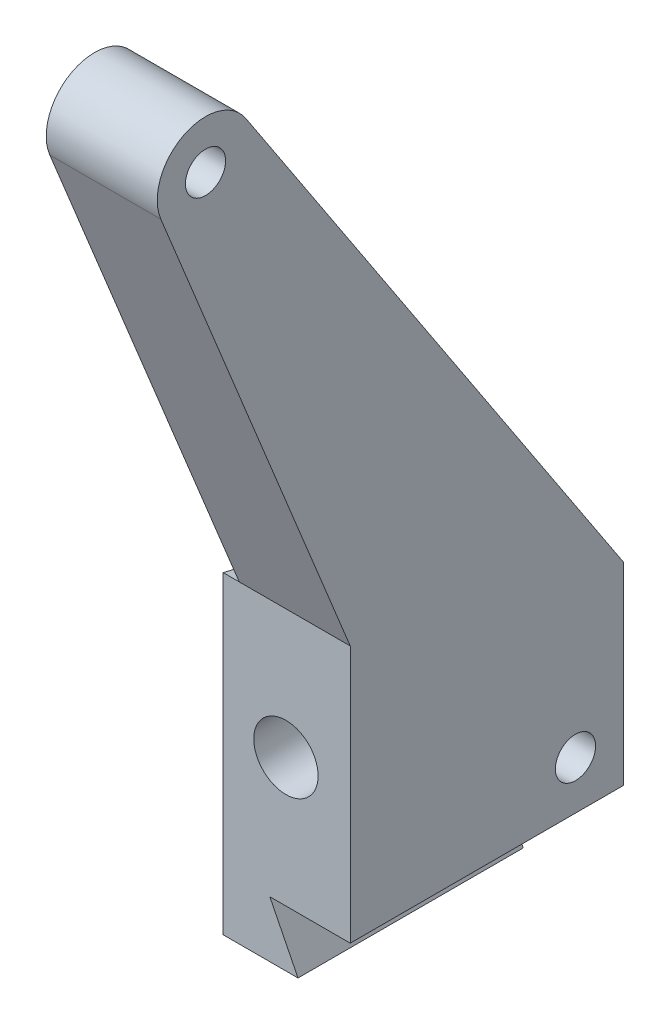
from build123d import *

# Parameters (mm, degrees)
SKETCH1_R             = 1.25
BOSS_EXTRUDE1_DEPTH   = 7.9
CUT_EXTRUDE2_DEPTH    = 61.929549481
M3X0_5_TAPPED_HOLE1_D = 2.5
SKETCH7_W             = 8
SKETCH7_H             = 0.5
CUT_EXTRUDE3_DEPTH    = 61.929549481
SKETCH8_R             = 2
CUT_EXTRUDE4_DEPTH    = 57.217523958
CUT_EXTRUDE5_DEPTH    = 3
CUT_EXTRUDE6_DEPTH    = 1
CUT_EXTRUDE8_DEPTH    = 3.9


with BuildPart() as part:
    # Sketch1 → Boss-Extrude1 (new body)
    with BuildSketch(Plane(origin=(0, 0, 0), x_dir=(0, 0, -1), z_dir=(1, 0, 0))):
        with BuildLine():
            Line((0, 0), (0, 16))
            Line((0, 16), (-23.49505807, 51.650837947))
            ThreePointArc((-23.49505807, 51.650837947), (-27.398738146, 52.653965259), (-28.777698581, 48.866690426))
            Line((-28.777698581, 48.866690426), (-17, 20))
            Line((-17, 20), (-17, 0))
            Line((-17, 0), (0, 0))
        make_face()
        with Locations((-26, 50)):
            Circle(SKETCH1_R, mode=Mode.SUBTRACT)
    extrude(amount=BOSS_EXTRUDE1_DEPTH)

    # Sketch3 → Cut-Extrude2 (cut, through all)
    with BuildSketch(Plane(origin=(0, 0, 0), x_dir=(-1, 0, 0), z_dir=(0, 0, -1))):
        Polygon((-7.9, 0), (-4.9, 0), (-2.9, 4), (-7.9, 4), align=None)
    extrude(amount=-CUT_EXTRUDE2_DEPTH, mode=Mode.SUBTRACT)

    # M3x0.5 Tapped Hole1 (through all)
    with Locations(Plane(origin=(7.9, 7, 3), x_dir=(0, 0, 1), z_dir=(1, 0, 0))):
        with Locations((0, 0)):
            Hole(M3X0_5_TAPPED_HOLE1_D / 2)

    # Sketch7 → Cut-Extrude3 (cut, through all)
    with BuildSketch(Plane(origin=(0, 0, 0), x_dir=(-1, 0, 0), z_dir=(0, 0, -1))):
        with Locations((-4, 0.25)):
            Rectangle(SKETCH7_W, SKETCH7_H)
    extrude(amount=-CUT_EXTRUDE3_DEPTH, mode=Mode.SUBTRACT)

    # Sketch8 → Cut-Extrude4 (cut, through all)
    with BuildSketch(Plane.XY.offset(17)):
        with Locations((3.9, 12)):
            Circle(SKETCH8_R)
    extrude(amount=-CUT_EXTRUDE4_DEPTH, mode=Mode.SUBTRACT)

    # Sketch9 → Cut-Extrude5 (cut)
    with BuildSketch(Plane(origin=(0, 0, 0), x_dir=(-1, 0, 0), z_dir=(0, 0, -1))):
        Polygon((-4.65, 0.5), (-2.9, 4), (0, 4), (0, 0.5), align=None)
    extrude(amount=-CUT_EXTRUDE5_DEPTH, mode=Mode.SUBTRACT)

    # Sketch11 → Cut-Extrude6 (cut)
    with BuildSketch(Plane.ZY):
        with BuildLine():
            Line((0, 16), (17, 20))
            Line((17, 20), (28.777698581, 48.866690426))
            ThreePointArc((28.777698581, 48.866690426), (27.398738146, 52.653965259), (23.49505807, 51.650837947))
            Line((23.49505807, 51.650837947), (0, 16))
        make_face()
    extrude(amount=-CUT_EXTRUDE6_DEPTH, mode=Mode.SUBTRACT)

    # Sketch14 → Cut-Extrude8 (cut, symmetric)
    with BuildSketch(Plane.ZY.offset(-1)):
        with BuildLine():
            Line((0, 16), (15.958100151, 40.214438659))
            ThreePointArc((15.958100151, 40.214438659), (15.69103598, 23.024770582), (0, 16))
        make_face()
    extrude(amount=CUT_EXTRUDE8_DEPTH, both=True, mode=Mode.SUBTRACT)


solid = part.part
